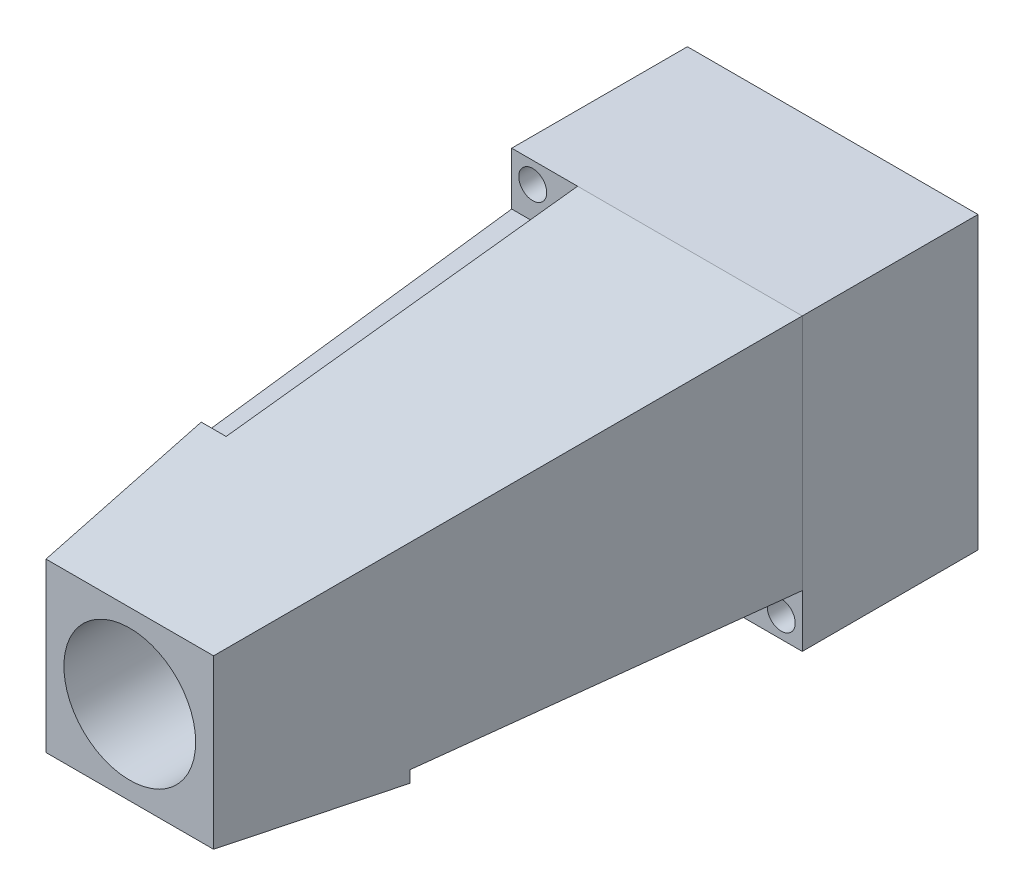
from build123d import *

# Parameters (mm, degrees)
SKETCH1_W           = 42
SKETCH1_H           = 42
SKETCH1_R           = 2.0193
SKETCH1_W_2         = 25.4
SKETCH1_H_2         = 25.4
BOSS_EXTRUDE2_DEPTH = 25.4
SKETCH17_R          = 9.525
CUT_EXTRUDE11_DEPTH = 149.304520227
SKETCH18_W          = 19.05
SKETCH18_H          = 50.8
CUT_EXTRUDE16_DEPTH = 7.62
SKETCH19_W          = 19.05
SKETCH19_H          = 50.8
CUT_EXTRUDE17_DEPTH = 7.62


with BuildPart() as part:
    # Sketch1 → Boss-Extrude2 (new body)
    with BuildSketch(Plane.XY):
        with Locations((-12.341618953, -81.761895361)):
            Rectangle(SKETCH1_W, SKETCH1_H)
        with Locations((-30.302131195, -63.801383119)):
            Circle(SKETCH1_R, mode=Mode.SUBTRACT)
        with Locations((5.618893289, -99.722407603)):
            Circle(SKETCH1_R, mode=Mode.SUBTRACT)
        with Locations((-12.341618953, -81.761895361)):
            Rectangle(SKETCH1_W_2, SKETCH1_H_2, mode=Mode.SUBTRACT)
    extrude(amount=BOSS_EXTRUDE2_DEPTH)

    # Sketch16 → Loft3 section 0
    with BuildSketch(Plane.XY.offset(25.4)):
        with BuildLine():
            Line((-33.341618953, -102.761895361), (-33.341618953, -60.761895361))
            Line((-33.341618953, -60.761895361), (8.658381047, -60.761895361))
            Line((8.658381047, -60.761895361), (8.658381047, -102.761895361))
            Line((8.658381047, -102.761895361), (-33.341618953, -102.761895361))
        make_face()
    # Sketch14 → Loft3 section 1
    with BuildSketch(Plane.XY.offset(101.6)):
        with BuildLine():
            Line((-0.231618953, -93.871895361), (-0.231618953, -69.651895361))
            Line((-0.231618953, -69.651895361), (-24.451618953, -69.651895361))
            Line((-24.451618953, -69.651895361), (-24.451618953, -93.871895361))
            Line((-24.451618953, -93.871895361), (-0.231618953, -93.871895361))
        make_face()
    loft()

    # Sketch17 → Cut-Extrude11 (cut, through all)
    with BuildSketch(Plane.XY.offset(101.6)):
        with Locations((-12.341618953, -81.761895361)):
            Circle(SKETCH17_R)
    extrude(amount=-CUT_EXTRUDE11_DEPTH, mode=Mode.SUBTRACT)

    # Sketch18 → Cut-Extrude16 (cut)
    with BuildSketch(Plane(origin=(0, -60.761895361, 0), x_dir=(1, 0, 0), z_dir=(0, 1, 0))):
        with Locations((-33.341618953, -50.8)):
            Rectangle(SKETCH18_W, SKETCH18_H)
    extrude(amount=-CUT_EXTRUDE16_DEPTH, mode=Mode.SUBTRACT)

    # Sketch19 → Cut-Extrude17 (cut)
    with BuildSketch(Plane.XZ.offset(102.761895361)):
        with Locations((8.658381047, 50.8)):
            Rectangle(SKETCH19_W, SKETCH19_H)
    extrude(amount=-CUT_EXTRUDE17_DEPTH, mode=Mode.SUBTRACT)


solid = part.part
